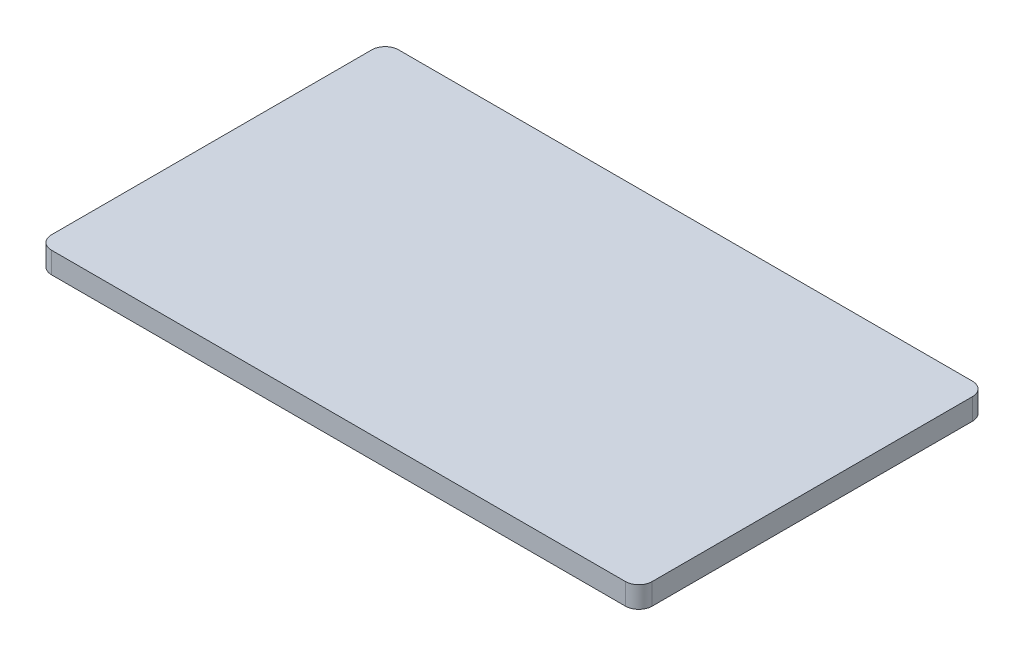
from build123d import *

# Parameters (mm, degrees)
SKETCH1_W           = 45
SKETCH1_H           = 26
BOSS_EXTRUDE1_DEPTH = 1.6
FILLET1_R           = 1


with BuildPart() as part:
    # Sketch1 → Boss-Extrude1 (new body)
    with BuildSketch(Plane(origin=(0, 0, 0), x_dir=(1, 0, 0), z_dir=(0, 1, 0))):
        Rectangle(SKETCH1_W, SKETCH1_H)
    extrude(amount=BOSS_EXTRUDE1_DEPTH)

    # Fillet1
    fillet1_edges = [part.edges().sort_by_distance(p)[0] for p in [
        (22.5, 0.8, 13),
        (-22.5, 0.8, 13),
        (-22.5, 0.8, -13),
        (22.5, 0.8, -13),
    ]]
    fillet(fillet1_edges, radius=FILLET1_R)


solid = part.part
